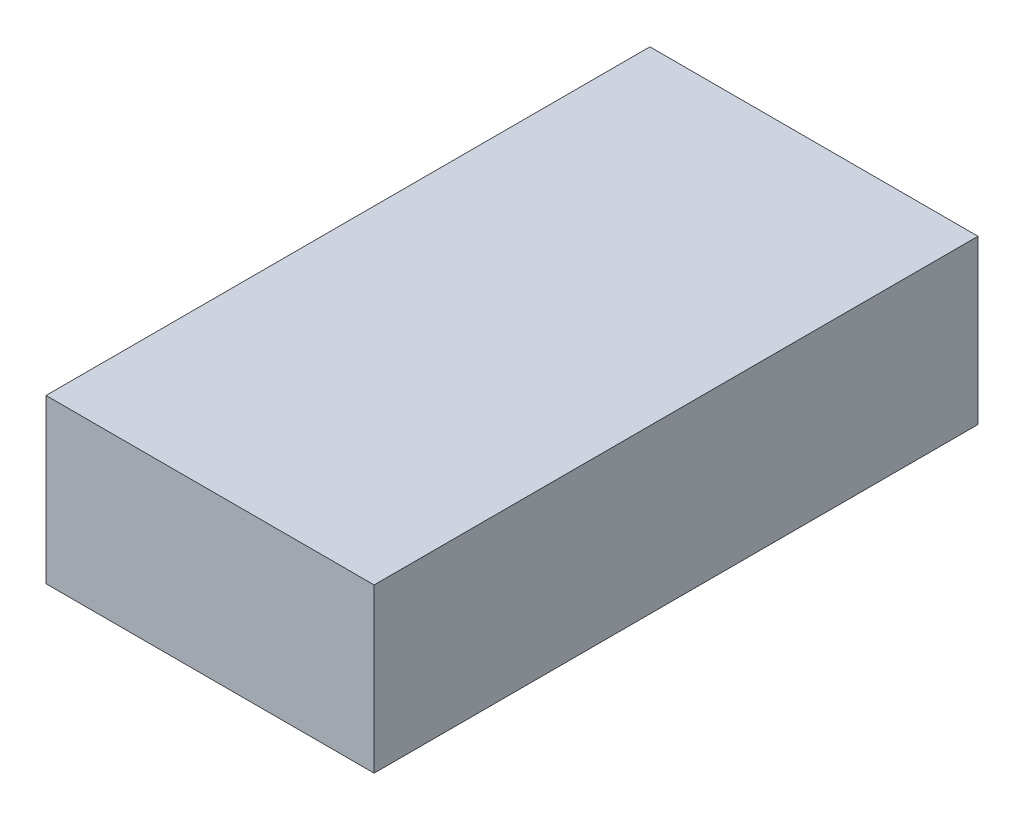
from build123d import *

# Parameters (mm, degrees)
SKETCH_1_W      = 81.5
SKETCH_1_H      = 40.5
EXTRUDE_1_DEPTH = 150


with BuildPart() as part:
    # 草图1 → 凸台-拉伸1 (new body)
    with BuildSketch(Plane.XY):
        with Locations((40.75, 20.25)):
            Rectangle(SKETCH_1_W, SKETCH_1_H)
    extrude(amount=EXTRUDE_1_DEPTH)


solid = part.part
